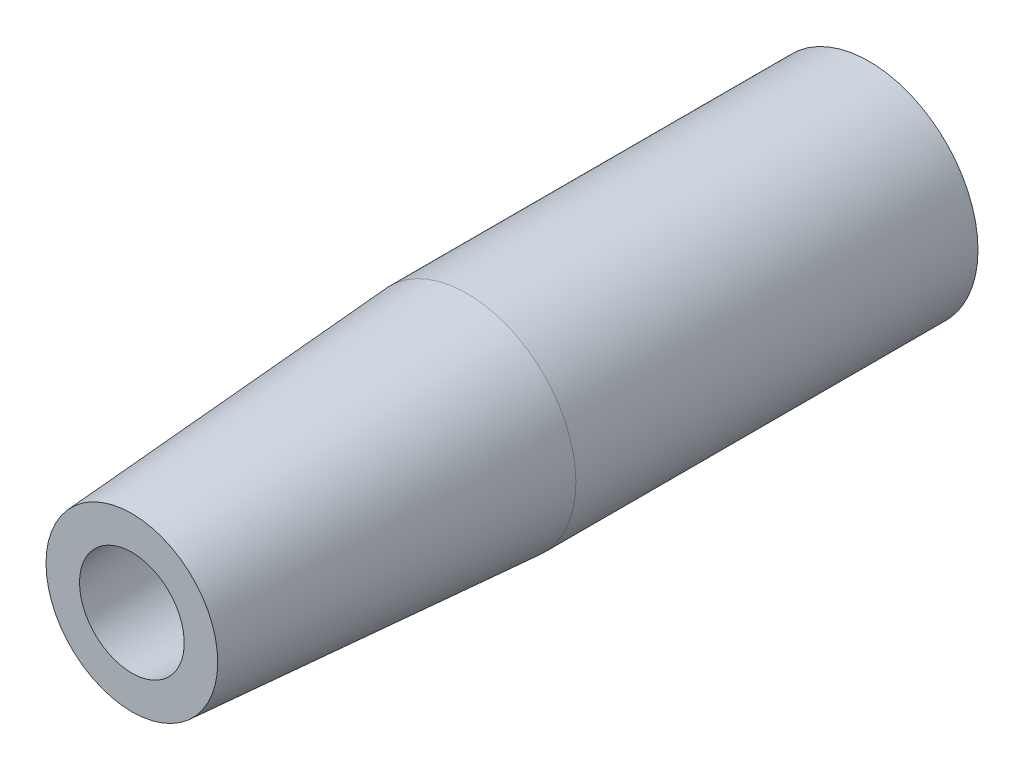
from build123d import *

# Parameters (mm, degrees)
SKETCH1_R           = 32.5
SKETCH1_R_2         = 22.5
BOSS_EXTRUDE1_DEPTH = 120


with BuildPart() as part:
    # Sketch1 → Boss-Extrude1 (new body)
    with BuildSketch(Plane.XY):
        Circle(SKETCH1_R)
        Circle(SKETCH1_R_2, mode=Mode.SUBTRACT)
    extrude(amount=BOSS_EXTRUDE1_DEPTH)

    # Sketch8 → Revolve1 (revolve)
    with BuildSketch(Plane(origin=(0, 0, 0), x_dir=(0, 0, -1), z_dir=(1, 0, 0)), mode=Mode.PRIVATE) as revolve1_sk:
        Polygon((-120, 32.5), (-220, 25.625), (-220, 15.625), (-120, 22.5), align=None)
    revolve(revolve1_sk.sketch.rotate(Axis((0, 0, -116.200591151), (0, 0, 1)), 90), axis=Axis((0, 0, -116.200591151), (0, 0, 1)))


solid = part.part
